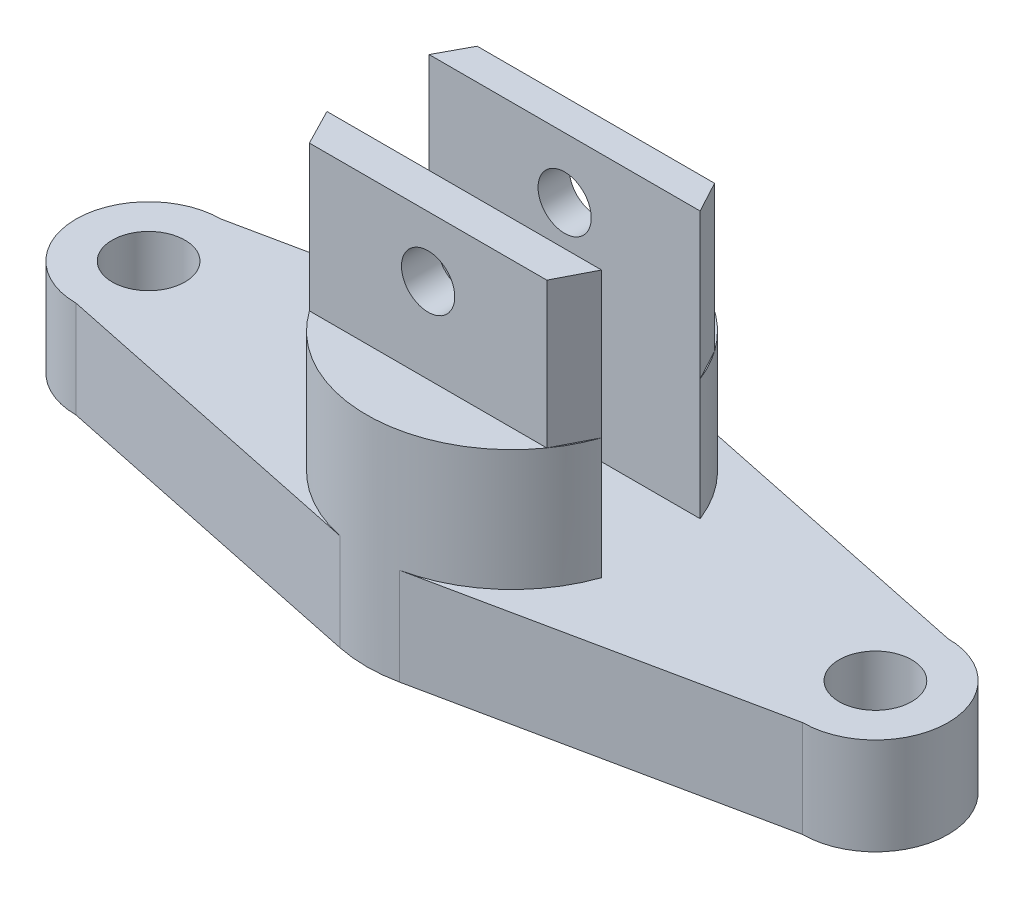
from build123d import *

# Parameters (mm, degrees)
CROQUIS2_R                 = 7.5
SALIENTE_EXTRUIR3_DEPTH    = 20
CROQUIS6_R                 = 30
SALIENTE_EXTRUIR4_DEPTH    = 25
CORTAR_EXTRUIR1_DEPTH      = 35
CORTAR_EXTRUIR1_DEPTH_BACK = 31
CROQUIS9_W                 = 20.718126327
CROQUIS9_H                 = 25
SALIENTE_EXTRUIR5_DEPTH    = 30
CORTAR_EXTRUIR2_DEPTH      = 15
CORTAR_EXTRUIR2_DEPTH_BACK = 38
CROQUIS11_R                = 5.492388524


with BuildPart() as part:
    # Croquis2 → Saliente-Extruir3 (new body)
    with BuildSketch(Plane(origin=(0, 0, 0), x_dir=(1, 0, 0), z_dir=(0, 1, 0))):
        with BuildLine():
            Line((-75, 15), (-6.126443354, 29.36778323))
            ThreePointArc((-6.126443354, 29.36778323), (0, 30), (6.126443354, 29.36778323))
            Line((6.126443354, 29.36778323), (75, 15))
            ThreePointArc((75, 15), (90, 0), (75, -15))
            Line((75, -15), (6.126443354, -29.36778323))
            ThreePointArc((6.126443354, -29.36778323), (0, -30), (-6.126443354, -29.36778323))
            Line((-6.126443354, -29.36778323), (-75, -15))
            ThreePointArc((-75, -15), (-90, 0), (-75, 15))
        make_face()
        with Locations((-75, 0)):
            Circle(CROQUIS2_R, mode=Mode.SUBTRACT)
        with Locations((75, 0)):
            Circle(CROQUIS2_R, mode=Mode.SUBTRACT)
    extrude(amount=SALIENTE_EXTRUIR3_DEPTH)

    # Croquis6 → Saliente-Extruir4 (add)
    with BuildSketch(Plane(origin=(0, 20, 0), x_dir=(1, 0, 0), z_dir=(0, 1, 0))):
        Circle(CROQUIS6_R)
    extrude(amount=SALIENTE_EXTRUIR4_DEPTH)

    # Croquis9 → Cortar-Extruir1 (cut, two sides: drawn at the far end of the back side and taken through both)
    with BuildSketch(Plane(origin=(0, 0, 0), x_dir=(0, 0, -1), z_dir=(1, 0, 0)).offset(-CORTAR_EXTRUIR1_DEPTH_BACK)):
        with Locations((0.502867144, 32.5)):
            Rectangle(CROQUIS9_W, CROQUIS9_H)
    extrude(amount=CORTAR_EXTRUIR1_DEPTH + CORTAR_EXTRUIR1_DEPTH_BACK, mode=Mode.SUBTRACT)

    # Croquis10 → Saliente-Extruir5 (add)
    with BuildSketch(Plane(origin=(0, 45, 0), x_dir=(1, 0, 0), z_dir=(0, 1, 0))):
        Polygon((-24.500615631, 17.312418483), (24.500615631, 17.312418483), (27.964593149, 10.861930307), (-27.964593149, 10.861930307), align=None)
        Polygon((-28.334703105, -9.85619602), (-24.500615631, -17.312418483), (24.500615631, -17.312418483), (28.334703105, -9.85619602), align=None)
    extrude(amount=SALIENTE_EXTRUIR5_DEPTH)

    # Croquis11 → Cortar-Extruir2 (cut, two sides: drawn at the far end of the back side and taken through both)
    with BuildSketch(Plane.XY.offset(17.312418483).offset(-CORTAR_EXTRUIR2_DEPTH_BACK)):
        with Locations((0, 62.511511295)):
            Circle(CROQUIS11_R)
    extrude(amount=CORTAR_EXTRUIR2_DEPTH + CORTAR_EXTRUIR2_DEPTH_BACK, mode=Mode.SUBTRACT)


solid = part.part
